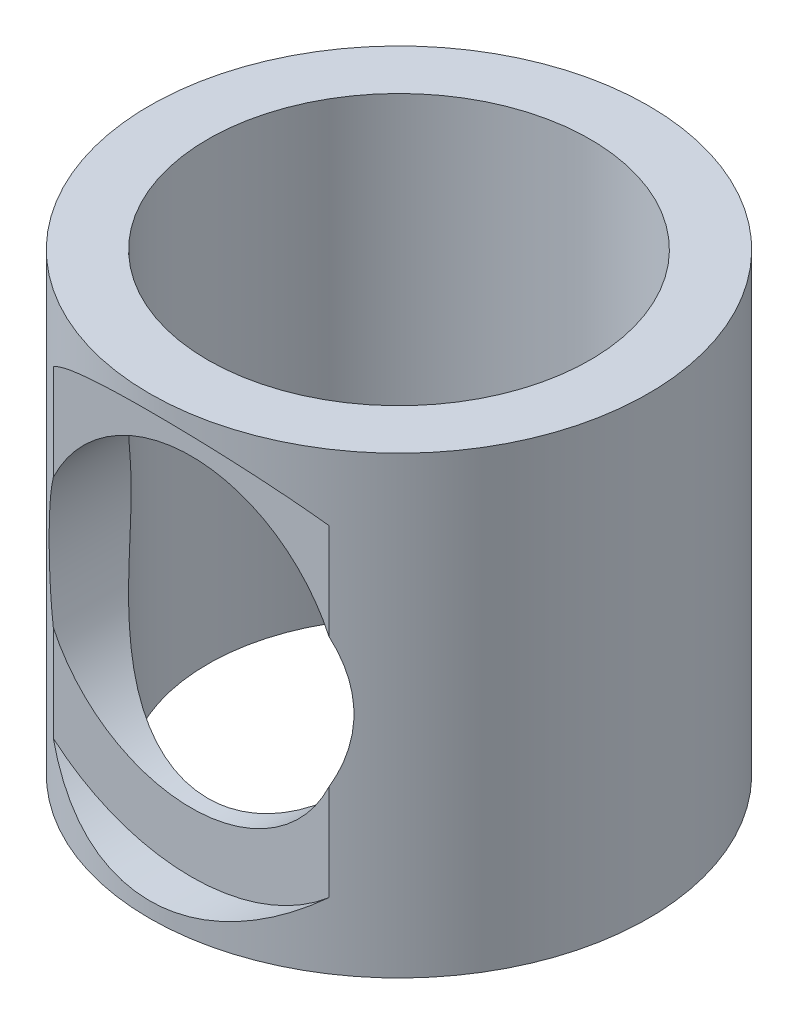
from build123d import *

# Parameters (mm, degrees)
SKETCH1_R               = 9
SKETCH1_R_2             = 6.9
BOSS_EXTRUDE1_DEPTH     = 16.4
CUT_EXTRUDE5_START      = 7.5
SKETCH3_R               = 7.65
CUT_EXTRUDE5_DEPTH      = 14.259576104
CUT_EXTRUDE6_DEPTH      = 25.944137756
CUT_EXTRUDE6_DEPTH_BACK = 7
SKETCH6_R               = 5.5


with BuildPart() as part:
    # Sketch1 → Boss-Extrude1 (new body)
    with BuildSketch(Plane(origin=(0, 0, 0), x_dir=(1, 0, 0), z_dir=(0, 1, 0))):
        with Locations(Location((0, 0, 0), (0, 0, 270))):
            Circle(SKETCH1_R)
        with Locations(Location((0, 0, 0), (0, 0, 270))):
            Circle(SKETCH1_R_2, mode=Mode.SUBTRACT)
    extrude(amount=-BOSS_EXTRUDE1_DEPTH)

    # Sketch3 → Cut-Extrude5 (cut, through all)
    with BuildSketch(Plane.XY.offset(CUT_EXTRUDE5_START)):
        with Locations((0, -8.2)):
            Circle(SKETCH3_R)
    extrude(amount=CUT_EXTRUDE5_DEPTH, mode=Mode.SUBTRACT)

    # Sketch6 → Cut-Extrude6 (cut, two sides: drawn at the far end of the back side and taken through both)
    with BuildSketch(Plane.XY.offset(7.5).offset(-CUT_EXTRUDE6_DEPTH_BACK)):
        with Locations(Location((0, -8.2, 0), (0, 0, 205.239401821))):
            Circle(SKETCH6_R)
    extrude(amount=CUT_EXTRUDE6_DEPTH + CUT_EXTRUDE6_DEPTH_BACK, mode=Mode.SUBTRACT)


solid = part.part
